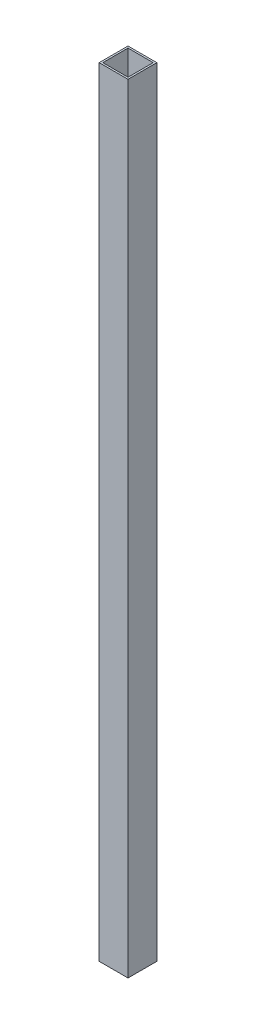
from build123d import *

# Parameters (mm, degrees)
SKETCH1_W           = 25.4
SKETCH1_H           = 25.4
SKETCH1_W_2         = 22.225
SKETCH1_H_2         = 22.225
BOSS_EXTRUDE1_DEPTH = 685.8


with BuildPart() as part:
    # Sketch1 → Boss-Extrude1 (new body)
    with BuildSketch(Plane(origin=(0, 0, 0), x_dir=(1, 0, 0), z_dir=(0, 1, 0))):
        Rectangle(SKETCH1_W, SKETCH1_H)
        Rectangle(SKETCH1_W_2, SKETCH1_H_2, mode=Mode.SUBTRACT)
    extrude(amount=BOSS_EXTRUDE1_DEPTH)


solid = part.part
